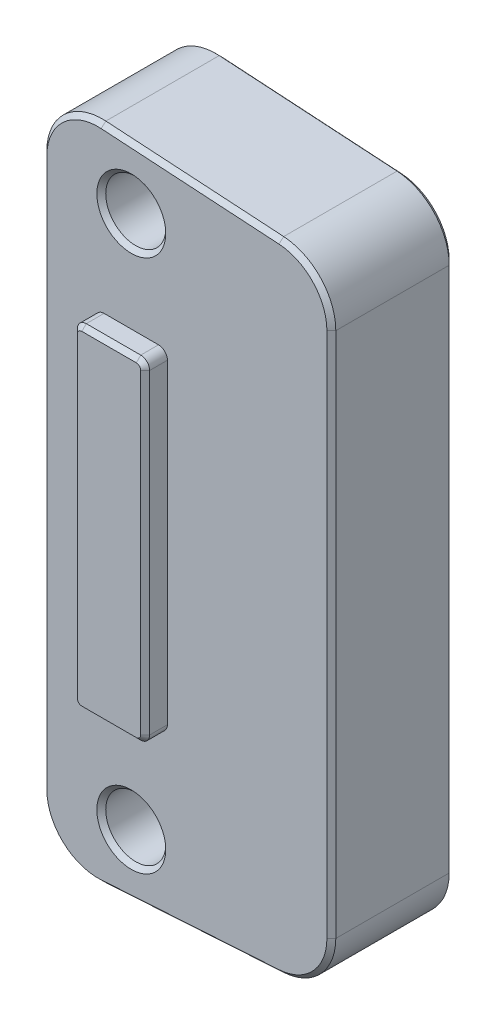
from build123d import *

# Parameters (mm, degrees)
SKETCH1_R           = 2.7
BOSS_EXTRUDE1_DEPTH = 11
SKETCH2_W           = 6.5
SKETCH2_H           = 30
BOSS_EXTRUDE2_DEPTH = 2
SKETCH3_W           = 7.8
SKETCH3_H           = 35.5
BOSS_EXTRUDE3_DEPTH = 1
FILLET1_R           = 5
FILLET2_R           = 0.45
FILLET3_R           = 0.8
FILLET4_R           = 0.65
FILLET5_R           = 1.85
CHAMFER1_SIZE       = 0.4


with BuildPart() as part:
    # Sketch1 → Boss-Extrude1 (new body)
    with BuildSketch(Plane.XY):
        Polygon((-13, -30), (-13, 30), (13, 28.375), (13, -28.375), align=None)
        with Locations((-5, -24)):
            Circle(SKETCH1_R, mode=Mode.SUBTRACT)
        with Locations((-5, 24)):
            Circle(SKETCH1_R, mode=Mode.SUBTRACT)
        Polygon((3.2, -17.75), (3.2, -12.35), (9.2, -12.35), (9.2, 12.35), (3.2, 12.35), (3.2, 17.75), (4.5, 17.75), (4.5, 15.547994765), (5.34, 14.15), (8.29, 14.15), (9.79, 15.65), (11, 15.65), (11, -15.65), (9.79, -15.65), (8.29, -14.15), (5.34, -14.15), (4.5, -15.547994765), (4.5, -17.75), align=None, mode=Mode.SUBTRACT)
    extrude(amount=BOSS_EXTRUDE1_DEPTH)

    # Sketch2 → Boss-Extrude2 (add)
    with BuildSketch(Plane.XY.offset(11)):
        with Locations((-5, 0)):
            Rectangle(SKETCH2_W, SKETCH2_H)
    extrude(amount=BOSS_EXTRUDE2_DEPTH)

    # Sketch3 → Boss-Extrude3 (add)
    with BuildSketch(Plane.XY.offset(11)):
        with Locations((7.1, 0)):
            Rectangle(SKETCH3_W, SKETCH3_H)
    extrude(amount=-BOSS_EXTRUDE3_DEPTH)

    # Fillet1
    fillet1_edges = [part.edges().sort_by_distance(p)[0] for p in [
        (-13, -30, 5.5),
        (-13, 30, 5.5),
        (13, 28.375, 5.5),
        (13, -28.375, 5.5),
    ]]
    fillet(fillet1_edges, radius=FILLET1_R)

    # Fillet2
    fillet2_edges = [part.edges().sort_by_distance(p)[0] for p in [
        (3.2, 17.75, 5),
        (4.5, 17.75, 5),
        (4.5, -17.75, 5),
        (3.2, -17.75, 5),
    ]]
    fillet(fillet2_edges, radius=FILLET2_R)

    # Fillet3
    fillet3_edges = [part.edges().sort_by_distance(p)[0] for p in [
        (5.34, 14.15, 5),
        (5.34, -14.15, 5),
        (-8.25, 15, 12),
        (-8.25, -15, 12),
        (-1.75, -15, 12),
        (-1.75, 15, 12),
    ]]
    fillet(fillet3_edges, radius=FILLET3_R)

    # Fillet4
    fillet4_edges = [part.edges().sort_by_distance(p)[0] for p in [
        (3.2, 12.35, 5),
        (3.2, -12.35, 5),
    ]]
    fillet(fillet4_edges, radius=FILLET4_R)

    # Fillet5
    fillet5_edges = [part.edges().sort_by_distance(p)[0] for p in [
        (9.2, -12.35, 5),
        (9.2, 12.35, 5),
    ]]
    fillet(fillet5_edges, radius=FILLET5_R)

    # Chamfer1
    chamfer1_edges = [part.edges().sort_by_distance(p)[0] for p in [
        (-7.7, -24, 0),
        (-7.7, -24, 11),
        (0.311891431, -29.168006786, 0),
        (0.311891431, -29.168006786, 11),
        (-13, 0, 0),
        (0.311891431, 29.168006786, 0),
        (13, 0, 0),
        (-11.423488195, 28.321880084, 0),
        (11.644136191, 27.101232088, 0),
        (11.644136191, -27.101232088, 0),
        (-11.423488195, -28.321880084, 0),
        (-13, 0, 11),
        (13, 0, 11),
        (0.311891431, 29.168006786, 11),
        (-11.423488195, 28.321880084, 11),
        (-7.7, 24, 0),
        (11.644136191, 27.101232088, 11),
        (11.644136191, -27.101232088, 11),
        (-11.423488195, -28.321880084, 11),
        (-7.7, 24, 11),
        (3.85, 17.75, 0),
        (3.2, 15.15, 0),
        (3.85, -17.75, 0),
        (4.5, -16.423997383, 0),
        (4.368198052, 17.618198052, 0),
        (3.331801948, 17.618198052, 0),
        (4.368198052, -17.618198052, 0),
        (3.331801948, -17.618198052, 0),
        (-5, -15, 13),
        (-8.25, 0, 13),
        (-1.75, 0, 13),
        (-5, 15, 13),
        (-1.984314575, -14.765685425, 13),
        (-8.015685425, 14.765685425, 13),
        (-1.984314575, 14.765685425, 13),
        (-8.015685425, -14.765685425, 13),
        (7.041309111, -14.15, 0),
        (4.803442191, 15.042982153, 0),
        (5.398679374, -14.253715443, 0),
        (5.398679374, 14.253715443, 0),
        (5.6, 12.35, 0),
        (3.2, -15.15, 0),
        (3.390380592, 12.540380592, 0),
        (3.390380592, -12.540380592, 0),
        (9.2, 0, 0),
        (5.6, -12.35, 0),
        (8.658147545, -11.808147545, 0),
        (8.658147545, 11.808147545, 0),
        (4.803442191, -15.042982153, 0),
        (9.04, -14.9, 0),
        (10.395, -15.65, 0),
        (11, 0, 0),
        (10.395, 15.65, 0),
        (9.04, 14.9, 0),
        (7.041309111, 14.15, 0),
        (4.5, 16.423997383, 0),
    ]]
    chamfer(chamfer1_edges, length=CHAMFER1_SIZE)


solid = part.part
